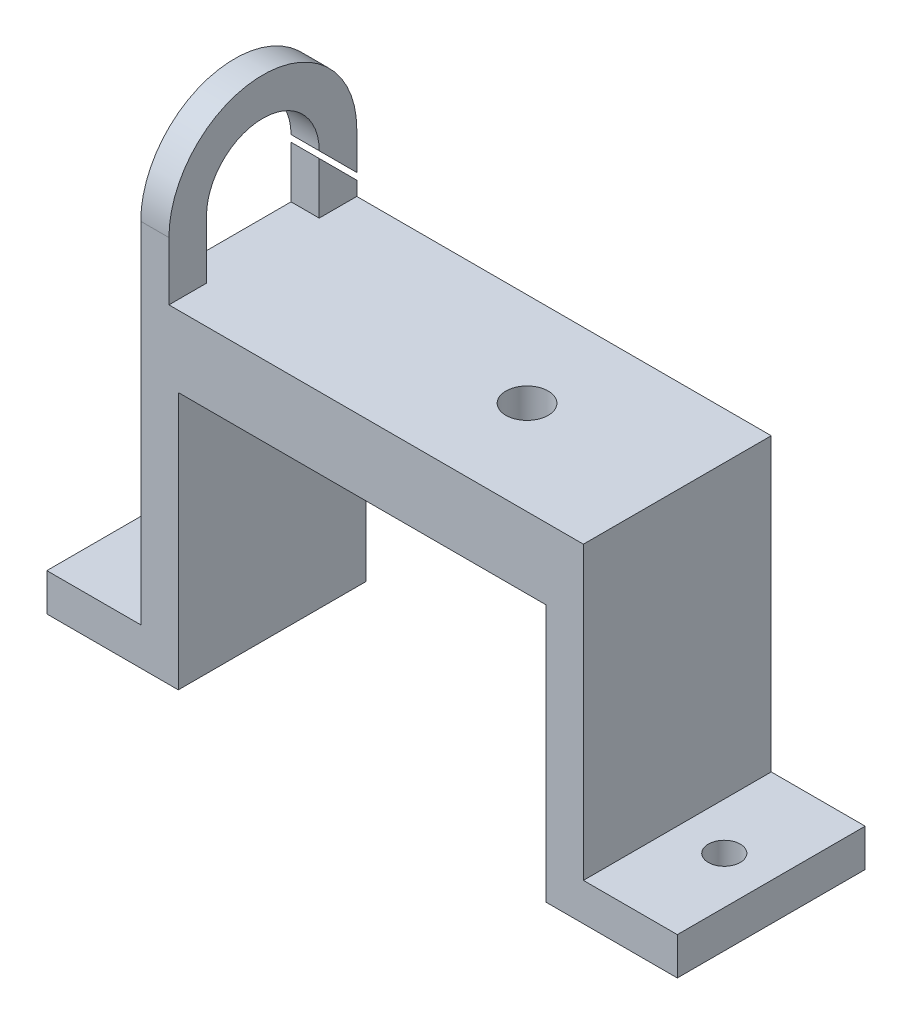
from build123d import *

# Parameters (mm, degrees)
BOSS_EXTRUDE1_DEPTH      = 10
BOSS_EXTRUDE2_START      = -19.5635
BOSS_EXTRUDE2_DEPTH      = 39.127
M3_CLEARANCE_HOLE1_D     = 3.4
M3_CLEARANCE_HOLE1_DEPTH = 7.5
M3_CLEARANCE_HOLE1_TIP   = 1.021463052
M4_CLEARANCE_HOLE1_D     = 4.5
BOSS_EXTRUDE3_DEPTH      = 3


with BuildPart() as part:
    # Sketch1 → Boss-Extrude1 (new, symmetric)
    with BuildSketch(Plane.XY):
        Polygon((-19.5635, 0), (19.5635, 0), (19.5635, -31), (33.5635, -31), (33.5635, -27), (23.5635, -27), (23.5635, 4), (-23.5635, 4), (-23.5635, -27), (-33.5635, -27), (-33.5635, -31), (-19.5635, -31), align=None)
    extrude(amount=BOSS_EXTRUDE1_DEPTH, both=True)

    # Sketch2 → Boss-Extrude2 (add)
    with BuildSketch(Plane(origin=(0, 0, 0), x_dir=(0, 0, -1), z_dir=(1, 0, 0)).offset(BOSS_EXTRUDE2_START)):
        with BuildLine():
            Line((5e-09, 0), (-10, 0))
            Line((-10, 0), (-10, -3.581906476))
            ThreePointArc((-10, -3.581906476), (-5.311074607, -0.922492235), (5e-09, 0))
        make_face()
        with BuildLine():
            Line((10, 0), (5e-09, 0))
            ThreePointArc((5e-09, 0), (5.311074611, -0.922492237), (10, -3.581906476))
            Line((10, -3.581906476), (10, 0))
        make_face()
    extrude(amount=BOSS_EXTRUDE2_DEPTH)

    # M3 Clearance Hole1
    with Locations(Plane(origin=(0, -27, 0), x_dir=(1, 0, 0), z_dir=(0, 1, 0))):
        with Locations((28.5635, 0), (-28.5635, 0)):
            Hole(M3_CLEARANCE_HOLE1_D / 2, depth=M3_CLEARANCE_HOLE1_DEPTH)
            with Locations((0, 0, -(M3_CLEARANCE_HOLE1_DEPTH + M3_CLEARANCE_HOLE1_TIP / 2))):  # 118° drill point
                Cone(0, M3_CLEARANCE_HOLE1_D / 2, M3_CLEARANCE_HOLE1_TIP, mode=Mode.SUBTRACT)

    # M4 Clearance Hole1 (through all)
    with Locations(Plane(origin=(0, 4, 0), x_dir=(1, 0, 0), z_dir=(0, 1, 0))):
        with Locations((7.5635, 0)):
            Hole(M4_CLEARANCE_HOLE1_D / 2)

    # Sketch7 → Boss-Extrude3 (add)
    with BuildSketch(Plane.ZY.offset(23.5635)):
        Polygon((-10, 4), (-10, 5.5), (-6, 9.5), (-6, 4), align=None)
        with BuildLine():
            Line((-10, 6.207106781), (-6, 10.207106781))
            ThreePointArc((-6, 10.207106781), (0, 16.207106781), (6, 10.207106781))
            Line((6, 10.207106781), (6, 4))
            Line((6, 4), (10, 4))
            Line((10, 4), (10, 10.207106781))
            ThreePointArc((10, 10.207106781), (0, 20.207106781), (-10, 10.207106781))
            Line((-10, 10.207106781), (-10, 6.207106781))
        make_face()
    extrude(amount=-BOSS_EXTRUDE3_DEPTH)


solid = part.part
